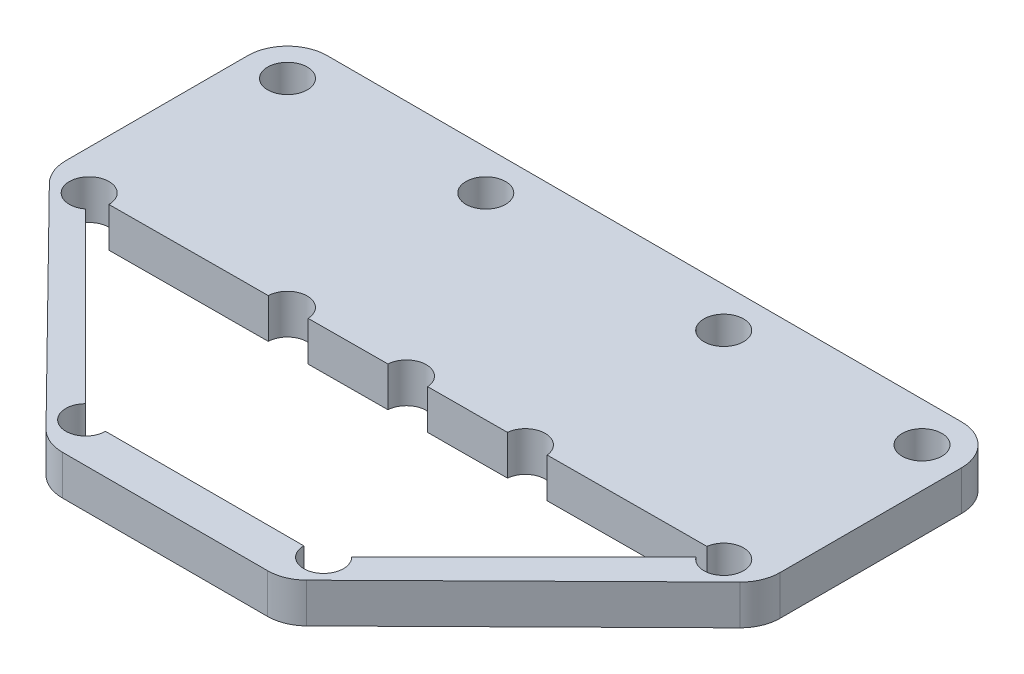
from build123d import *

# Parameters (mm, degrees)
BOSS_EXTRUDE1_DEPTH = 12.7
SKETCH2_R           = 6.35
CUT_EXTRUDE1_DEPTH  = 182.323455578
CUT_EXTRUDE10_DEPTH = 182.323455578


with BuildPart() as part:
    # Sketch1 → Boss-Extrude1 (new body)
    with BuildSketch(Plane(origin=(0, 0, 0), x_dir=(1, 0, 0), z_dir=(0, 1, 0))):
        with BuildLine():
            Line((-131.471489953, 109.23134636), (71.728510047, 109.23134636))
            ThreePointArc((71.728510047, 109.23134636), (80.708766168, 105.511602481), (84.428510047, 96.53134636))
            Line((84.428510047, 96.53134636), (84.428510047, 38.349564826))
            ThreePointArc((84.428510047, 38.349564826), (83.442873319, 33.444088994), (80.638952072, 29.300033185))
            Line((80.638952072, 29.300033185), (10.746499625, -39.518185281))
            ThreePointArc((10.746499625, -39.518185281), (6.650668081, -42.220654573), (1.836057601, -43.16865364))
            Line((1.836057601, -43.16865364), (-63.841823784, -43.16865364))
            ThreePointArc((-63.841823784, -43.16865364), (-68.748013198, -42.182718068), (-72.892440933, -39.377993078))
            Line((-72.892440933, -39.377993078), (-140.522107103, 29.324094297))
            ThreePointArc((-140.522107103, 29.324094297), (-143.22378415, 33.419539146), (-144.171489953, 38.233433734))
            Line((-144.171489953, 38.233433734), (-144.171489953, 96.53134636))
            ThreePointArc((-144.171489953, 96.53134636), (-140.451746074, 105.511602481), (-131.471489953, 109.23134636))
        make_face()
    extrude(amount=BOSS_EXTRUDE1_DEPTH)

    # Sketch2 → Cut-Extrude1 (cut, through all)
    with BuildSketch(Plane(origin=(0, 12.7, 0), x_dir=(1, 0, 0), z_dir=(0, 1, 0))):
        with Locations(Location((-69.102883091, -30.46865364, 0), (0, 0, 270))):
            Circle(SKETCH2_R)
        with Locations(Location((7.097116909, -30.46865364, 0), (0, 0, 270))):
            Circle(SKETCH2_R)
        with Locations(Location((-67.971489953, 96.53134636, 0), (0, 0, 270))):
            Circle(SKETCH2_R)
        with Locations(Location((8.228510047, 96.53134636, 0), (0, 0, 270))):
            Circle(SKETCH2_R)
        with Locations(Location((-67.971489286, 33.021266411, 0), (0, 0, 270))):
            Circle(SKETCH2_R)
        with Locations(Location((8.228510047, 33.03134636, 0), (0, 0, 270))):
            Circle(SKETCH2_R)
        with Locations(Location((-131.471489953, 96.53134636, 0), (0, 0, 270))):
            Circle(SKETCH2_R)
        with Locations(Location((-131.471489953, 33.03134636, 0), (0, 0, 270))):
            Circle(SKETCH2_R)
        with Locations(Location((71.728510047, 96.53134636, 0), (0, 0, 270))):
            Circle(SKETCH2_R)
        with Locations(Location((71.728510047, 33.03134636, 0), (0, 0, 270))):
            Circle(SKETCH2_R)
        with Locations(Location((-29.871490619, 33.03134636, 0), (0, 0, 270))):
            Circle(SKETCH2_R)
    extrude(amount=-CUT_EXTRUDE1_DEPTH, mode=Mode.SUBTRACT)

    # Sketch3 → Cut-Extrude10 (cut, through all)
    with BuildSketch(Plane(origin=(0, 12.7, 0), x_dir=(1, 0, 0), z_dir=(0, 1, 0))):
        Polygon((-132.534139195, 32.962602464), (-69.102883091, -30.46865364), (7.097116909, -30.46865364), (71.522699324, 33.956928775), align=None)
    extrude(amount=-CUT_EXTRUDE10_DEPTH, mode=Mode.SUBTRACT)


solid = part.part
